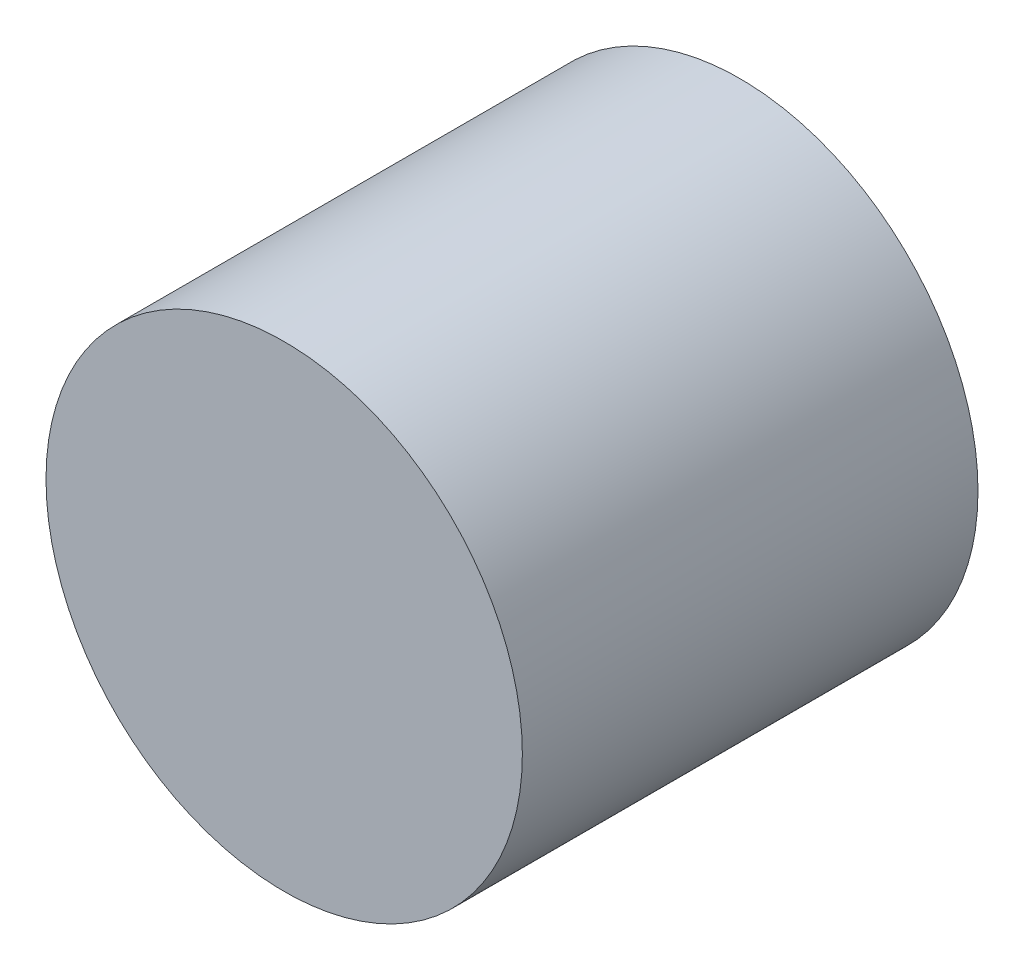
from build123d import *

# Parameters (mm, degrees)
SKETCH_1_R      = 23
EXTRUDE_1_DEPTH = 44


with BuildPart() as part:
    # 草图1 → 凸台-拉伸1 (new body)
    with BuildSketch(Plane.XY):
        Circle(SKETCH_1_R)
    extrude(amount=EXTRUDE_1_DEPTH)


solid = part.part
